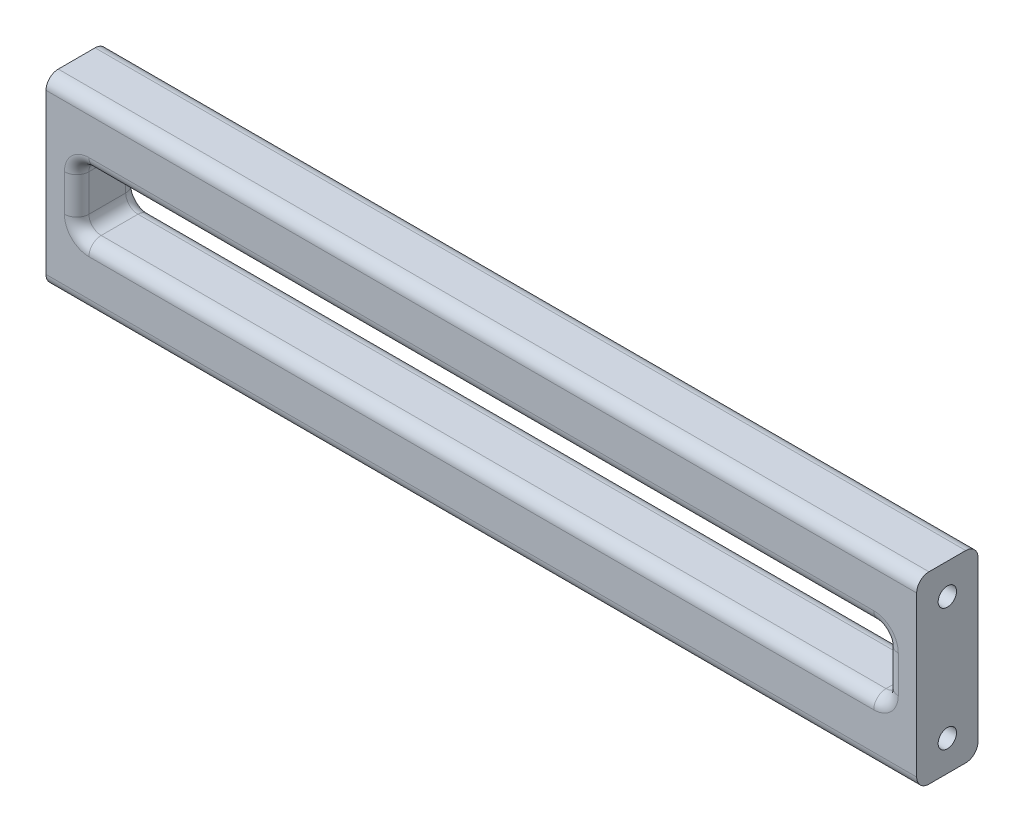
from build123d import *

# Parameters (mm, degrees)
SKETCH1_W           = 12.7
SKETCH1_H           = 38.1
SKETCH1_R           = 1.905
BOSS_EXTRUDE1_DEPTH = 180.34
SKETCH3_W           = 167.64
SKETCH3_H           = 12.7
CUT_EXTRUDE1_DEPTH  = 182.787535601
FILLET1_R           = 2.54


with BuildPart() as part:
    # Sketch1 → Boss-Extrude1 (new body)
    with BuildSketch(Plane(origin=(0, 0, 0), x_dir=(0, 0, -1), z_dir=(1, 0, 0))):
        Rectangle(SKETCH1_W, SKETCH1_H)
        with Locations((0, -12.7)):
            Circle(SKETCH1_R, mode=Mode.SUBTRACT)
        with Locations((0, 12.7)):
            Circle(SKETCH1_R, mode=Mode.SUBTRACT)
    extrude(amount=-BOSS_EXTRUDE1_DEPTH)

    # Sketch3 → Cut-Extrude1 (cut, through all)
    with BuildSketch(Plane.XY.offset(6.35)):
        with Locations((-90.17, 0)):
            Rectangle(SKETCH3_W, SKETCH3_H)
    extrude(amount=-CUT_EXTRUDE1_DEPTH, mode=Mode.SUBTRACT)

    # Fillet1
    fillet1_edges = [part.edges().sort_by_distance(p)[0] for p in [
        (-6.35, 0, -6.35),
        (-6.35, 6.35, 0),
        (-90.17, -6.35, -6.35),
        (-6.35, -6.35, 0),
        (-173.99, 0, -6.35),
        (-173.99, -6.35, 0),
        (-90.17, 6.35, -6.35),
        (-173.99, 6.35, 0),
        (-6.35, 0, 6.35),
        (-90.17, 6.35, 6.35),
        (-173.99, 0, 6.35),
        (-90.17, -6.35, 6.35),
        (-90.17, 19.05, 6.35),
        (-90.17, 19.05, -6.35),
        (-90.17, -19.05, -6.35),
        (-90.17, -19.05, 6.35),
    ]]
    fillet(fillet1_edges, radius=FILLET1_R)


solid = part.part
